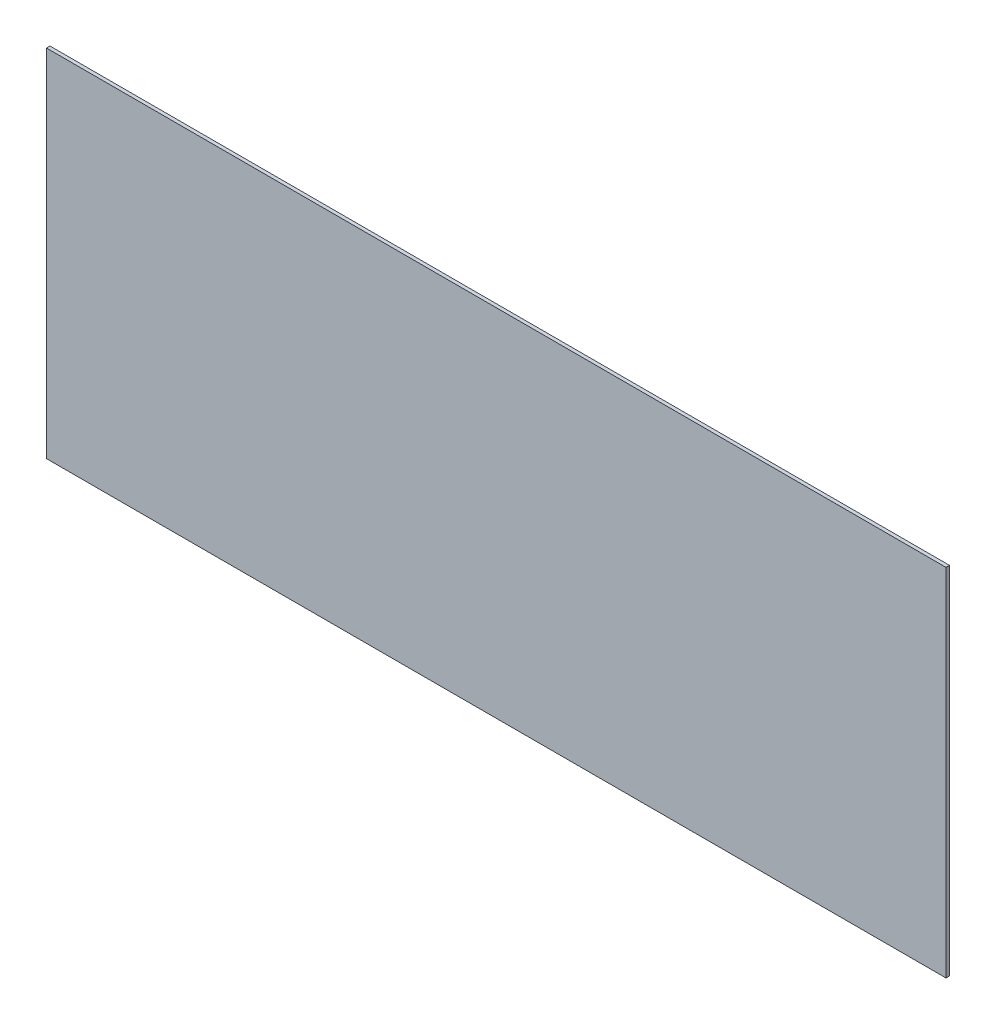
from build123d import *

# Parameters (mm, degrees)
SKETCH_1_W      = 129
SKETCH_1_H      = 51
EXTRUDE_1_DEPTH = 0.5


with BuildPart() as part:
    # ｽｹｯﾁ1 → ﾎﾞｽ - 押し出し1 (new body)
    with BuildSketch(Plane.XY):
        Rectangle(SKETCH_1_W, SKETCH_1_H)
    extrude(amount=EXTRUDE_1_DEPTH)


solid = part.part
